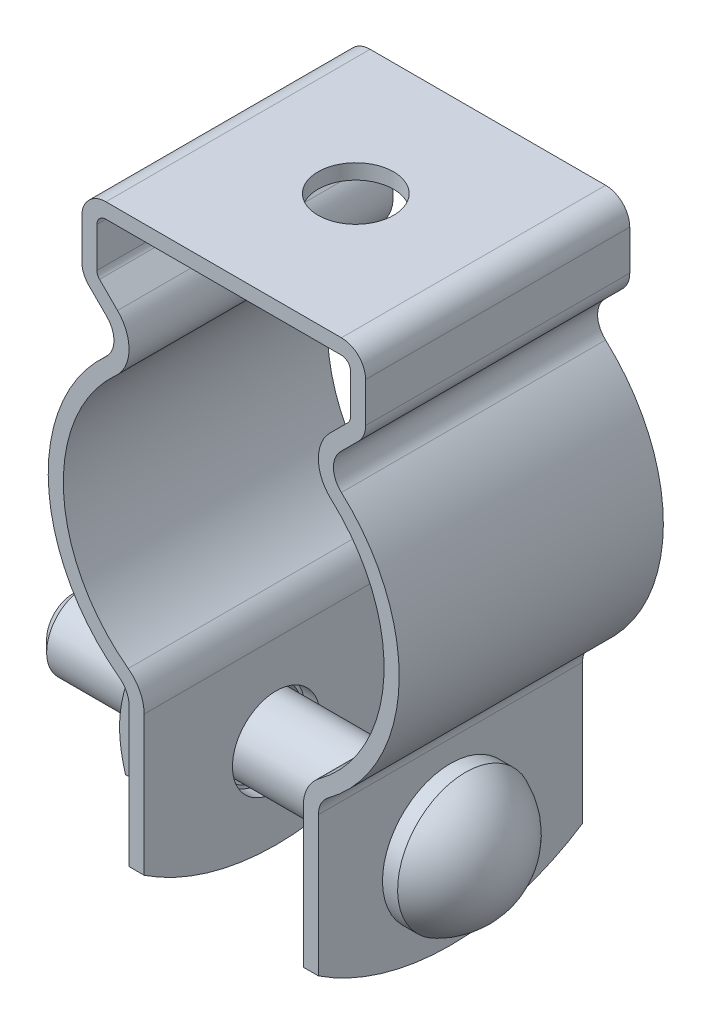
from build123d import *

# Parameters (mm, degrees)
BOSS_EXTRUDE1_DEPTH     = 11.1125
SKETCH2_R               = 3.175
CUT_EXTRUDE2_DEPTH      = 35.029202096
CUT_EXTRUDE5_DEPTH      = 39.804249354
CUT_EXTRUDE5_DEPTH_BACK = 39.804249354
SKETCH8_R               = 3.683
CHAMFER1_SIZE           = 0.9525
BOSS_EXTRUDE2_DEPTH     = 6.35
SKETCH10_OUTSIDE_W      = 187.574
SKETCH10_OUTSIDE_H      = 216.15
SKETCH10_OUTSIDE_R      = 5.55625
CUT_EXTRUDE6_DEPTH      = 43.255900172
CUT_EXTRUDE6_DRAFT      = -60
SKETCH11_OUTSIDE_W      = 173.406
SKETCH11_OUTSIDE_H      = 201.98
SKETCH11_OUTSIDE_R      = 5.55625
CUT_EXTRUDE7_DEPTH      = 39.165301237
CUT_EXTRUDE7_DRAFT      = -60
CUT_EXTRUDE3_DEPTH      = 39.804249354
CUT_EXTRUDE3_DEPTH_BACK = 39.804249354


with BuildPart() as part:
    # Sketch1 → Boss-Extrude1 (new, symmetric)
    with BuildSketch(Plane.XY):
        with BuildLine():
            Line((-11.342840979, 15.406534021), (-9.829627985, 13.893321026))
            ThreePointArc((-9.829627985, 13.893321026), (-9.235107004, 12.40556259), (-9.903417898, 10.949457886))
            ThreePointArc((-9.903417898, 10.949457886), (-14.746105665, -0.721582839), (-8.787066292, -11.864054115))
            ThreePointArc((-8.787066292, -11.864054115), (-8.181733414, -12.582757694), (-7.964468964, -13.496956187))
            Line((-7.964468964, -13.496956187), (-7.964468964, -28.575))
            Line((-7.964468964, -28.575), (-6.694468964, -28.575))
            Line((-6.694468964, -28.575), (-6.694468964, -13.496956187))
            ThreePointArc((-6.694468964, -13.496956187), (-7.047523696, -12.011383636), (-8.031189621, -10.84349032))
            ThreePointArc((-8.031189621, -10.84349032), (-13.477623457, -0.659511197), (-9.051510982, 10.007569035))
            ThreePointArc((-9.051510982, 10.007569035), (-7.965505779, 12.373739179), (-8.931602372, 14.791346638))
            Line((-8.931602372, 14.791346638), (-10.444815367, 16.304559633))
            ThreePointArc((-10.444815367, 16.304559633), (-10.609996204, 16.551770225), (-10.668, 16.843375))
            Line((-10.668, 16.843375), (-10.668, 20.193))
            ThreePointArc((-10.668, 20.193), (-10.444815367, 20.731815367), (-9.906, 20.955))
            Line((-9.906, 20.955), (9.906, 20.955))
            ThreePointArc((9.906, 20.955), (10.444815367, 20.731815367), (10.668, 20.193))
            Line((10.668, 20.193), (10.668, 16.843375))
            ThreePointArc((10.668, 16.843375), (10.609996204, 16.551770225), (10.444815367, 16.304559633))
            Line((10.444815367, 16.304559633), (8.931602372, 14.791346638))
            ThreePointArc((8.931602372, 14.791346638), (7.965505779, 12.373739179), (9.051510982, 10.007569035))
            ThreePointArc((9.051510982, 10.007569035), (13.477623457, -0.659511197), (8.031189621, -10.84349032))
            ThreePointArc((8.031189621, -10.84349032), (7.047523696, -12.011383636), (6.694468964, -13.496956187))
            Line((6.694468964, -13.496956187), (6.694468964, -28.575))
            Line((6.694468964, -28.575), (7.964468964, -28.575))
            Line((7.964468964, -28.575), (7.964468964, -13.496956187))
            ThreePointArc((7.964468964, -13.496956187), (8.181733414, -12.582757694), (8.787066292, -11.864054115))
            ThreePointArc((8.787066292, -11.864054115), (14.746105665, -0.721582839), (9.903417898, 10.949457886))
            ThreePointArc((9.903417898, 10.949457886), (9.235107004, 12.40556259), (9.829627985, 13.893321026))
            Line((9.829627985, 13.893321026), (11.342840979, 15.406534021))
            ThreePointArc((11.342840979, 15.406534021), (11.78332321, 16.065762265), (11.938, 16.843375))
            Line((11.938, 16.843375), (11.938, 20.193))
            ThreePointArc((11.938, 20.193), (11.342840979, 21.629840979), (9.906, 22.225))
            Line((9.906, 22.225), (-9.906, 22.225))
            ThreePointArc((-9.906, 22.225), (-11.342840979, 21.629840979), (-11.938, 20.193))
            Line((-11.938, 20.193), (-11.938, 16.843375))
            ThreePointArc((-11.938, 16.843375), (-11.78332321, 16.065762265), (-11.342840979, 15.406534021))
        make_face()
    extrude(amount=BOSS_EXTRUDE1_DEPTH, both=True)

    # Sketch2 → Cut-Extrude2 (cut, through all)
    with BuildSketch(Plane(origin=(0, 0, 0), x_dir=(1, 0, 0), z_dir=(0, 1, 0))):
        Circle(SKETCH2_R)
    extrude(amount=CUT_EXTRUDE2_DEPTH, mode=Mode.SUBTRACT)

    # Sketch8 → Cut-Extrude5 (cut, two sides: drawn at the far end of the back side and taken through both)
    with BuildSketch(Plane(origin=(0, 0, 0), x_dir=(0, 0, -1), z_dir=(1, 0, 0)).offset(-CUT_EXTRUDE5_DEPTH_BACK)):
        with Locations((0, -21.035978094)):
            Circle(SKETCH8_R)
    extrude(amount=CUT_EXTRUDE5_DEPTH + CUT_EXTRUDE5_DEPTH_BACK, mode=Mode.SUBTRACT)

    # Sketch3 → Cut-Extrude3 (cut, two sides: drawn at the far end of the back side and taken through both)
    with BuildSketch(Plane(origin=(0, 0, 0), x_dir=(0, 0, -1), z_dir=(1, 0, 0)).offset(-CUT_EXTRUDE3_DEPTH_BACK)):
        with BuildLine():
            Line((11.1125, -31.90875), (11.1125, -25.24125))
            ThreePointArc((11.1125, -25.24125), (0, -28.575), (-11.1125, -25.24125))
            Line((-11.1125, -25.24125), (-11.1125, -31.90875))
            Line((-11.1125, -31.90875), (11.1125, -31.90875))
        make_face()
    extrude(amount=CUT_EXTRUDE3_DEPTH + CUT_EXTRUDE3_DEPTH_BACK, mode=Mode.SUBTRACT)


with BuildPart() as body_2:
    # Sketch4 → Revolve1 (revolve)
    with BuildSketch(Plane.XY):
        with BuildLine():
            Line((-23.785531036, -17.860978094), (7.964468964, -17.860978094))
            Line((7.964468964, -17.860978094), (7.964468964, -15.320978094))
            Line((7.964468964, -15.320978094), (9.234468964, -15.320978094))
            ThreePointArc((9.234468964, -15.320978094), (12.004650349, -17.601690504), (13.044468964, -21.035978094))
            Line((13.044468964, -21.035978094), (-23.785531036, -21.035978094))
            Line((-23.785531036, -21.035978094), (-23.785531036, -17.860978094))
        make_face()
    revolve(axis=Axis((13.044468964, -21.035978094, 0), (-1, 0, 0)))

    # Chamfer1
    chamfer1_edges = [body_2.edges().sort_by_distance(p)[0] for p in [
        (-23.785531036, -24.210978094, 0),
    ]]
    chamfer(chamfer1_edges, length=CHAMFER1_SIZE)


with BuildPart() as body_3:
    # Sketch9 → Boss-Extrude2 (new body)
    with BuildSketch(Plane.ZY.offset(7.964468964)):
        Polygon((0, -27.45178296), (5.55625, -24.243880527), (5.55625, -17.82807566), (0, -14.620173227), (-5.55625, -17.82807566), (-5.55625, -24.243880527), align=None)
    extrude(amount=BOSS_EXTRUDE2_DEPTH)


with BuildPart() as cut_extrude6_tool:
    # Sketch10 outside → Cut-Extrude6 (with draft: the straight prism first)
    with BuildSketch(Plane.ZY.offset(14.314468964)):
        with Locations((0, -3.175)):
            Rectangle(SKETCH10_OUTSIDE_W, SKETCH10_OUTSIDE_H)
        with Locations((0, -21.035978094)):
            Circle(SKETCH10_OUTSIDE_R, mode=Mode.SUBTRACT)
    extrude(amount=-CUT_EXTRUDE6_DEPTH)
    # Cut-Extrude6: the draft: its side faces are tilted about the plane it starts from
    cut_extrude6_sides = [cut_extrude6_tool.faces().sort_by_distance(p)[0] for p in [
        (7.313481122, -111.25, 0),
        (7.313481122, -3.175, 93.787),
        (7.313481122, 104.9, 0),
        (7.313481122, -3.175, -93.787),
        (7.313481122, -21.035978094, -5.55625),
    ]]
    draft(cut_extrude6_sides, Plane.ZY.offset(14.314468964), CUT_EXTRUDE6_DRAFT)


with BuildPart() as body_3_1:
    add(body_3.part)

    # Cut-Extrude6: cut by cut_extrude6_tool
    add(cut_extrude6_tool.part, mode=Mode.SUBTRACT)


with BuildPart() as cut_extrude7_tool:
    # Sketch11 outside → Cut-Extrude7 (with draft: the straight prism first)
    with BuildSketch(Plane(origin=(-7.964468964, 0, 0), x_dir=(0, 0, -1), z_dir=(1, 0, 0))):
        with Locations((0, -3.175)):
            Rectangle(SKETCH11_OUTSIDE_W, SKETCH11_OUTSIDE_H)
        with Locations((0, -21.035978094)):
            Circle(SKETCH11_OUTSIDE_R, mode=Mode.SUBTRACT)
    extrude(amount=-CUT_EXTRUDE7_DEPTH)
    # Cut-Extrude7: the draft: its side faces are tilted about the plane it starts from
    cut_extrude7_sides = [cut_extrude7_tool.faces().sort_by_distance(p)[0] for p in [
        (-27.547119582, -104.165, 0),
        (-27.547119582, -3.175, -86.703),
        (-27.547119582, 97.815, 0),
        (-27.547119582, -3.175, 86.703),
        (-27.547119582, -21.035978094, 5.55625),
    ]]
    draft(cut_extrude7_sides, Plane(origin=(-7.964468964, 0, 0), x_dir=(0, 0, -1), z_dir=(1, 0, 0)), CUT_EXTRUDE7_DRAFT)


with BuildPart() as body_3_2:
    add(body_3_1.part)

    # Cut-Extrude7: cut by cut_extrude7_tool
    add(cut_extrude7_tool.part, mode=Mode.SUBTRACT)

    # Cut-Extrude8 cone 1 section (through the dimple's axis) → Cut-Extrude8 (revolve, cut)
    with BuildSketch(Plane(origin=(-14.314468964, -21.035978094, 0), x_dir=(0, 0, 1), z_dir=(0, 1, 0))):
        Polygon((0, 0), (3.429, 0), (0, 3.429), align=None)
    revolve(axis=Axis((-14.314468964, -21.035978094, 0), (1, 0, 0)), mode=Mode.SUBTRACT)

    # Cut-Extrude9 cone 1 section (through the dimple's axis) → Cut-Extrude9 (revolve, cut)
    with BuildSketch(Plane(origin=(-7.964468964, -21.035978094, 0), x_dir=(0, 0, -1), z_dir=(0, 1, 0))):
        Polygon((0, 0), (3.429, 0), (0, 3.429), align=None)
    revolve(axis=Axis((-7.964468964, -21.035978094, 0), (-1, 0, 0)), mode=Mode.SUBTRACT)


solid = Compound([part.part, body_2.part, body_3_2.part])
